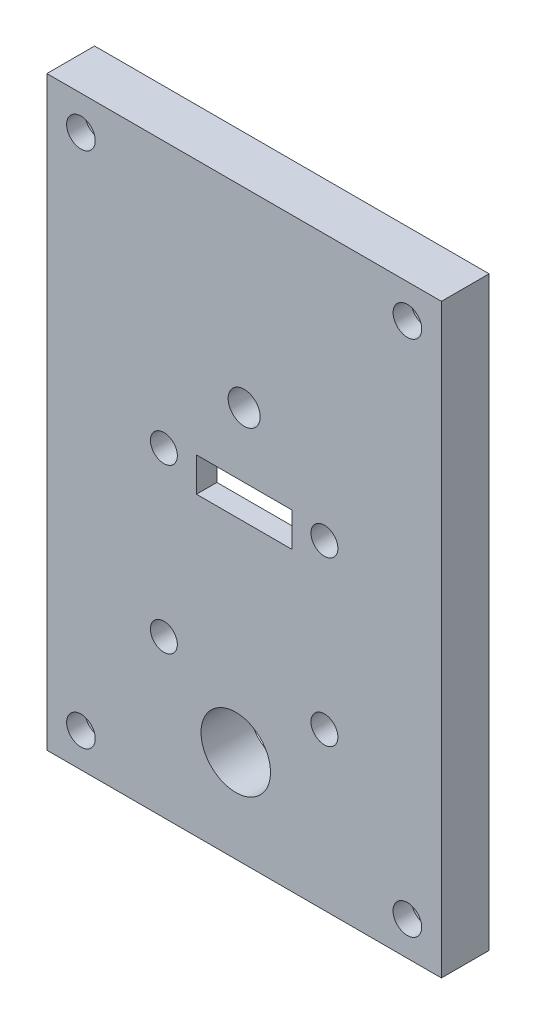
from build123d import *

# Parameters (mm, degrees)
ESQUISSE1_W             = 57.9
ESQUISSE1_H             = 86
BOSS_EXTRU_1_DEPTH      = 7
ESQUISSE3_R             = 2.1
ESQUISSE3_R_2           = 5.1
ENL_V_MAT_EXTRU_2_DEPTH = 53.30776711
ESQUISSE4_R             = 3.75
ENL_V_MAT_EXTRU_3_DEPTH = 4.3
ESQUISSE6_R             = 3.75
ENL_V_MAT_EXTRU_5_DEPTH = 4.3
ESQUISSE7_W             = 28
ESQUISSE7_H             = 29
ENL_V_MAT_EXTRU_6_DEPTH = 4
ESQUISSE9_R             = 1.975
ESQUISSE9_W             = 14
ESQUISSE9_H             = 5
ENL_V_MAT_EXTRU_7_DEPTH = 52.991369476
ESQUISSE10_R            = 2.35
ENL_V_MAT_EXTRU_8_DEPTH = 53.30776711


with BuildPart() as part:
    # Esquisse1 → Boss.-Extru.1 (new body)
    with BuildSketch(Plane.XY):
        Rectangle(ESQUISSE1_W, ESQUISSE1_H)
    extrude(amount=BOSS_EXTRU_1_DEPTH)

    # Esquisse3 → Enlèv. mat.-Extru.2 (cut, through all)
    with BuildSketch(Plane(origin=(0, 0, 0), x_dir=(-1, 0, 0), z_dir=(0, 0, -1))):
        with Locations((23.95, 38)):
            Circle(ESQUISSE3_R)
        with Locations((-23.960388264, 38.019803714)):
            Circle(ESQUISSE3_R)
        with Locations((23.95, -38)):
            Circle(ESQUISSE3_R)
        with Locations((-23.95, -38)):
            Circle(ESQUISSE3_R)
        with Locations((1.229278893, -29.411147051)):
            Circle(ESQUISSE3_R_2)
    extrude(amount=-ENL_V_MAT_EXTRU_2_DEPTH, mode=Mode.SUBTRACT)

    # Esquisse4 → Enlèv. mat.-Extru.3 (cut)
    with BuildSketch(Plane(origin=(0, 0, 0), x_dir=(-1, 0, 0), z_dir=(0, 0, -1))):
        with Locations((23.95, -38)):
            Circle(ESQUISSE4_R)
        with Locations((-23.95, -38)):
            Circle(ESQUISSE4_R)
        with Locations((23.95, 38)):
            Circle(ESQUISSE4_R)
    extrude(amount=-ENL_V_MAT_EXTRU_3_DEPTH, mode=Mode.SUBTRACT)

    # Esquisse6 → Enlèv. mat.-Extru.5 (cut)
    with BuildSketch(Plane(origin=(0, 0, 0), x_dir=(-1, 0, 0), z_dir=(0, 0, -1))):
        with Locations((-23.95, 38)):
            Circle(ESQUISSE6_R)
    extrude(amount=-ENL_V_MAT_EXTRU_5_DEPTH, mode=Mode.SUBTRACT)

    # Esquisse7 → Enlèv. mat.-Extru.6 (cut)
    with BuildSketch(Plane(origin=(0, 0, 0), x_dir=(-1, 0, 0), z_dir=(0, 0, -1))):
        with Locations((0, -8)):
            Rectangle(ESQUISSE7_W, ESQUISSE7_H)
    extrude(amount=-ENL_V_MAT_EXTRU_6_DEPTH, mode=Mode.SUBTRACT)

    # Esquisse9 → Enlèv. mat.-Extru.7 (cut, through all)
    with BuildSketch(Plane(origin=(0, 0, 4), x_dir=(-1, 0, 0), z_dir=(0, 0, -1))):
        with Locations((11.78, -19.99)):
            Circle(ESQUISSE9_R)
        with Locations((-11.78, -19.99)):
            Circle(ESQUISSE9_R)
        with Locations((-11.78, 3.99)):
            Circle(ESQUISSE9_R)
        with Locations((11.78, 3.99)):
            Circle(ESQUISSE9_R)
        with Locations((0, 3.01)):
            Rectangle(ESQUISSE9_W, ESQUISSE9_H)
    extrude(amount=-ENL_V_MAT_EXTRU_7_DEPTH, mode=Mode.SUBTRACT)

    # Esquisse10 → Enlèv. mat.-Extru.8 (cut, through all)
    with BuildSketch(Plane(origin=(0, 0, 0), x_dir=(-1, 0, 0), z_dir=(0, 0, -1))):
        with Locations((0, 15)):
            Circle(ESQUISSE10_R)
    extrude(amount=-ENL_V_MAT_EXTRU_8_DEPTH, mode=Mode.SUBTRACT)


solid = part.part
